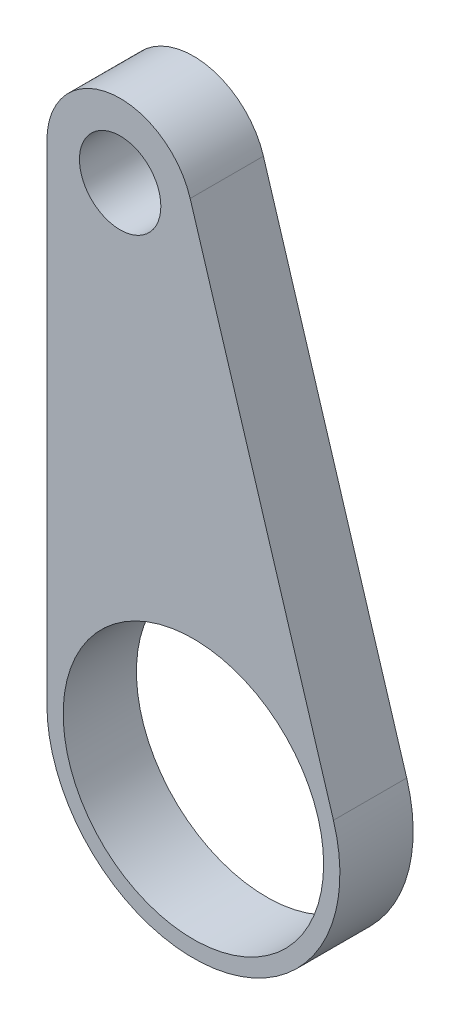
from build123d import *

# Parameters (mm, degrees)
SKETCH_1_R      = 2.5
SKETCH_1_R_2    = 8
EXTRUDE_1_DEPTH = 4.5


with BuildPart() as part:
    # 스케치1 → 보스-돌출1 (new body)
    with BuildSketch(Plane.XY):
        with BuildLine():
            Line((-9, 30), (-9, 0))
            ThreePointArc((-9, 0), (1.335064076, -8.900427176), (8.60391198, 2.640586797))
            Line((8.60391198, 2.640586797), (-0.19804401, 31.320293399))
            ThreePointArc((-0.19804401, 31.320293399), (-5.167532038, 34.450213588), (-9, 30))
        make_face()
        with Locations((-4.5, 30)):
            Circle(SKETCH_1_R, mode=Mode.SUBTRACT)
        Circle(SKETCH_1_R_2, mode=Mode.SUBTRACT)
    extrude(amount=EXTRUDE_1_DEPTH)


solid = part.part
